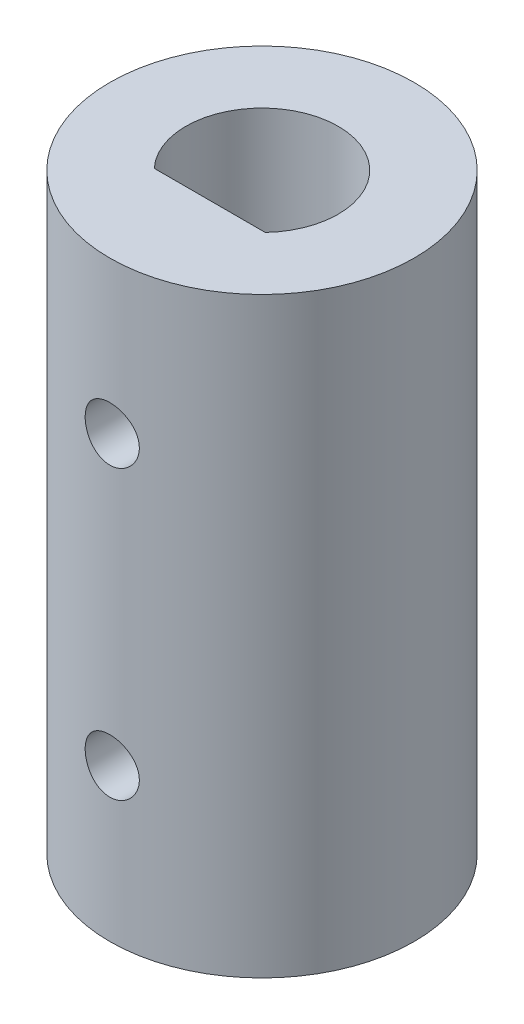
from build123d import *

# Parameters (mm, degrees)
SKETCH1_R           = 6.35
BOSS_EXTRUDE1_DEPTH = 12.35
SKETCH4_R           = 6.35
BOSS_EXTRUDE2_DEPTH = 12.35
SKETCH5_R           = 1.13
CUT_EXTRUDE2_DEPTH  = 28.253825364


with BuildPart() as part:
    # Sketch1 → Boss-Extrude1 (new body)
    with BuildSketch(Plane(origin=(0, 0, 0), x_dir=(1, 0, 0), z_dir=(0, 1, 0))):
        with Locations(Location((0, 0, 0), (0, 0, 270))):
            Circle(SKETCH1_R)
        with BuildLine():
            Line((-2.742383206, -3.260332823), (2.742383206, -3.260332823))
            ThreePointArc((2.742383206, -3.260332823), (0, 4.260332823), (-2.742383206, -3.260332823))
        make_face(mode=Mode.SUBTRACT)
    extrude(amount=BOSS_EXTRUDE1_DEPTH)

    # Sketch4 → Boss-Extrude2 (add)
    with BuildSketch(Plane(origin=(0, 12.35, 0), x_dir=(1, 0, 0), z_dir=(0, 1, 0))):
        with Locations(Location((0, 0, 0), (0, 0, 270))):
            Circle(SKETCH4_R)
        with BuildLine():
            Line((-2.315167381, -2.18), (2.315167381, -2.18))
            ThreePointArc((2.315167381, -2.18), (0, 3.18), (-2.315167381, -2.18))
        make_face(mode=Mode.SUBTRACT)
    extrude(amount=BOSS_EXTRUDE2_DEPTH)

    # Sketch5 → Cut-Extrude2 (cut, through all)
    with BuildSketch(Plane(origin=(0, 0, 3.260332823), x_dir=(-1, 0, 0), z_dir=(0, 0, -1))):
        with Locations((0, 18.35)):
            Circle(SKETCH5_R)
        with Locations(Location((0, 6.35, 0), (0, 0, 270))):
            Circle(SKETCH5_R)
    extrude(amount=-CUT_EXTRUDE2_DEPTH, mode=Mode.SUBTRACT)


solid = part.part
